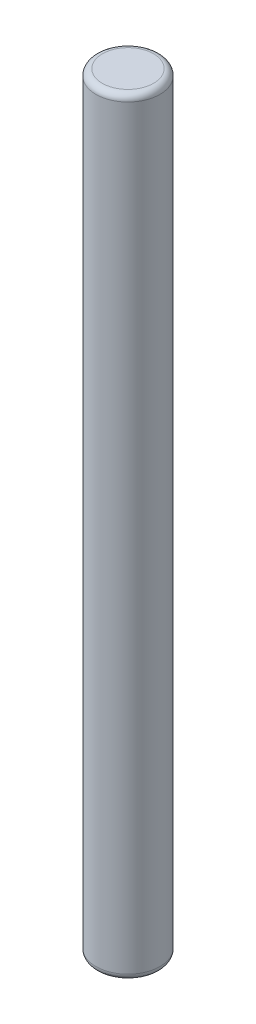
from build123d import *

# Parameters (mm, degrees)
SKETCH2_R           = 1
BOSS_EXTRUDE1_DEPTH = 24
FILLET1_R           = 0.2


with BuildPart() as part:
    # Sketch2 → Boss-Extrude1 (new body)
    with BuildSketch(Plane(origin=(0, 0, 0), x_dir=(1, 0, 0), z_dir=(0, 1, 0))):
        with Locations(Location((0, 0, 0), (0, 0, 270))):
            Circle(SKETCH2_R)
    extrude(amount=BOSS_EXTRUDE1_DEPTH)

    # Fillet1
    fillet1_edges = [part.edges().sort_by_distance(p)[0] for p in [
        (0, 0, -1),
        (0, 24, -1),
    ]]
    fillet(fillet1_edges, radius=FILLET1_R)


solid = part.part
